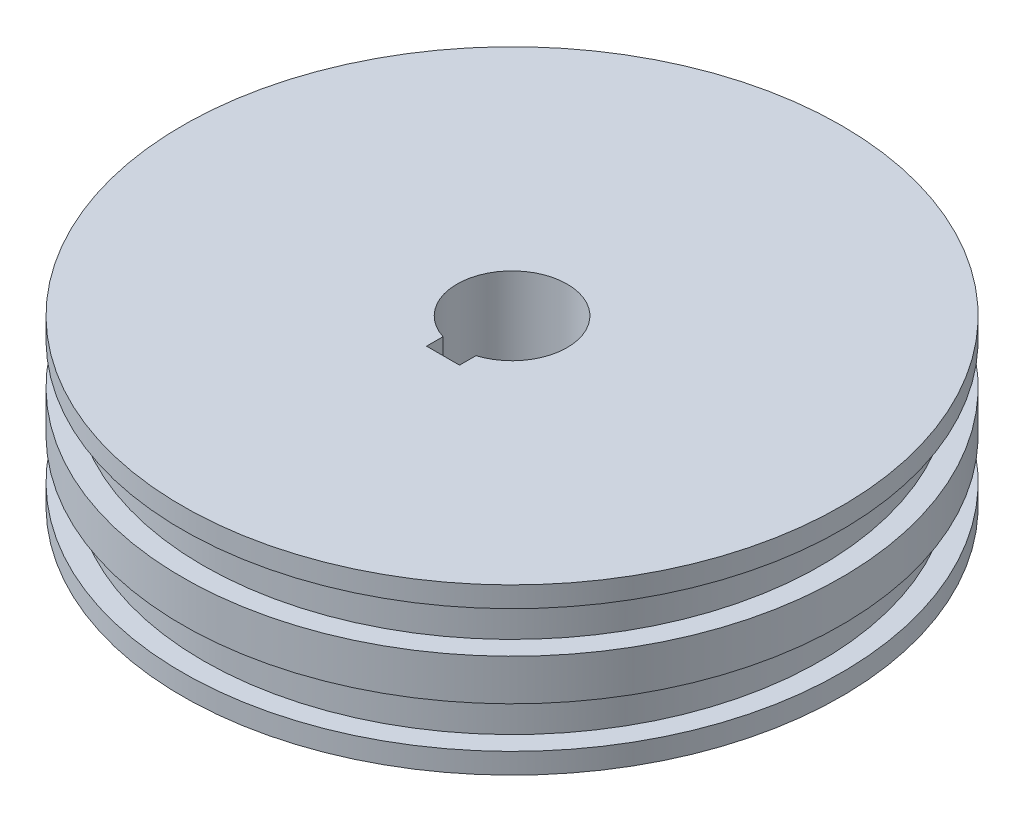
from build123d import *

# Parameters (mm, degrees)
CUT_EXTRUDE1_DEPTH = 121


with BuildPart() as part:
    # Sketch1 → Revolve1 (revolve)
    with BuildSketch(Plane(origin=(0, 0, 0), x_dir=(0, 0, -1), z_dir=(1, 0, 0))):
        Polygon((10, 0), (80, 0), (80, 5), (75, 5), (75, 15), (80, 15), (80, 25), (75, 25), (75, 35), (80, 35), (80, 40), (10, 40), align=None)
    revolve(axis=Axis((0, 0, 0), (0, 1, 0)))

    # Sketch2 → Cut-Extrude1 (cut, through all)
    with BuildSketch(Plane.XZ):
        with BuildLine():
            Line((-4, 16.756133146), (4, 16.756133146))
            Line((4, 16.756133146), (4, 12.756133146))
            ThreePointArc((4, 12.756133146), (0, -13.36858006), (-4, 12.756133146))
            Line((-4, 12.756133146), (-4, 16.756133146))
        make_face()
    extrude(amount=-CUT_EXTRUDE1_DEPTH, mode=Mode.SUBTRACT)


solid = part.part
